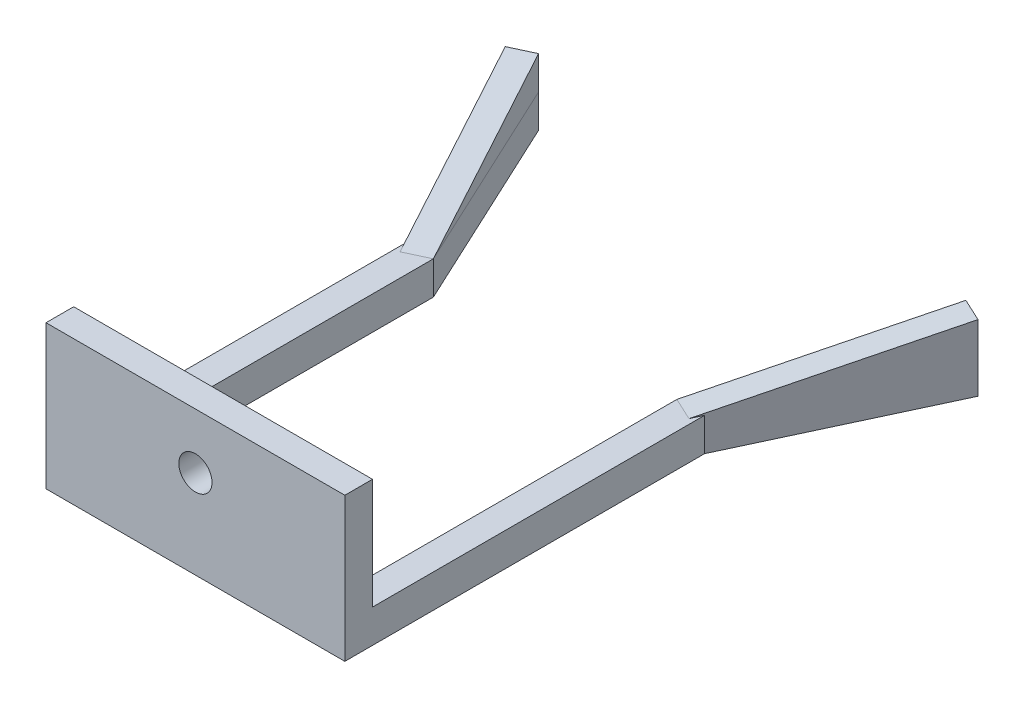
from build123d import *

# Parameters (mm, degrees)
BOSS_EXTRUDE1_DEPTH = 3
BOSS_EXTRUDE2_DEPTH = 2.265769468
SKETCH3_W           = 27
SKETCH3_H           = 2.5
BOSS_EXTRUDE3_DEPTH = 10
SKETCH4_R           = 1.5
CUT_EXTRUDE1_DEPTH  = 54.950363002


with BuildPart() as part:
    # Sketch1 → Boss-Extrude1 (new body)
    with BuildSketch(Plane(origin=(0, 0, 0), x_dir=(1, 0, 0), z_dir=(0, 1, 0))):
        Polygon((-13.5, -2.5), (13.5, -2.5), (13.5, 30), (21.357064951, 46.849530162), (19.303580439, 47.807085716), (11, 30), (11, 0), (-11, 0), (-11, 30), (-19.303580439, 47.807085716), (-21.357064951, 46.849530162), (-13.5, 30), align=None)
    extrude(amount=BOSS_EXTRUDE1_DEPTH)


with BuildPart() as body_2:
    # Sketch2 → Boss-Extrude2 (new body)
    with BuildSketch(Plane(origin=(2.455334794, 0, -1.144941418), x_dir=(-0.42261826174070094, 0, -0.9063077870366493), z_dir=(0.9063077870366493, 0, -0.42261826174070094))):
        Polygon((31.83803449, 3), (51.48597967, 6), (51.48597967, 3), align=None)
    boss_extrude2 = extrude(amount=-BOSS_EXTRUDE2_DEPTH)


with BuildPart() as part_1:
    add(part.part)

    # Mirror4: Boss-Extrude2 across plane
    add(boss_extrude2.mirror(Plane(origin=(0, 0, 0), x_dir=(0, 0, 1), z_dir=(1, 0, 0))))

    # Sketch3 → Boss-Extrude3 (add)
    with BuildSketch(Plane(origin=(0, 3, 0), x_dir=(1, 0, 0), z_dir=(0, 1, 0))):
        with Locations((0, -1.25)):
            Rectangle(SKETCH3_W, SKETCH3_H)
    extrude(amount=BOSS_EXTRUDE3_DEPTH)

    # Sketch4 → Cut-Extrude1 (cut, through all)
    with BuildSketch(Plane(origin=(0, 0, 0), x_dir=(-1, 0, 0), z_dir=(0, 0, -1))):
        with Locations((0, 8)):
            Circle(SKETCH4_R)
    extrude(amount=-CUT_EXTRUDE1_DEPTH, mode=Mode.SUBTRACT)


solid = Compound([body_2.part, part_1.part])
